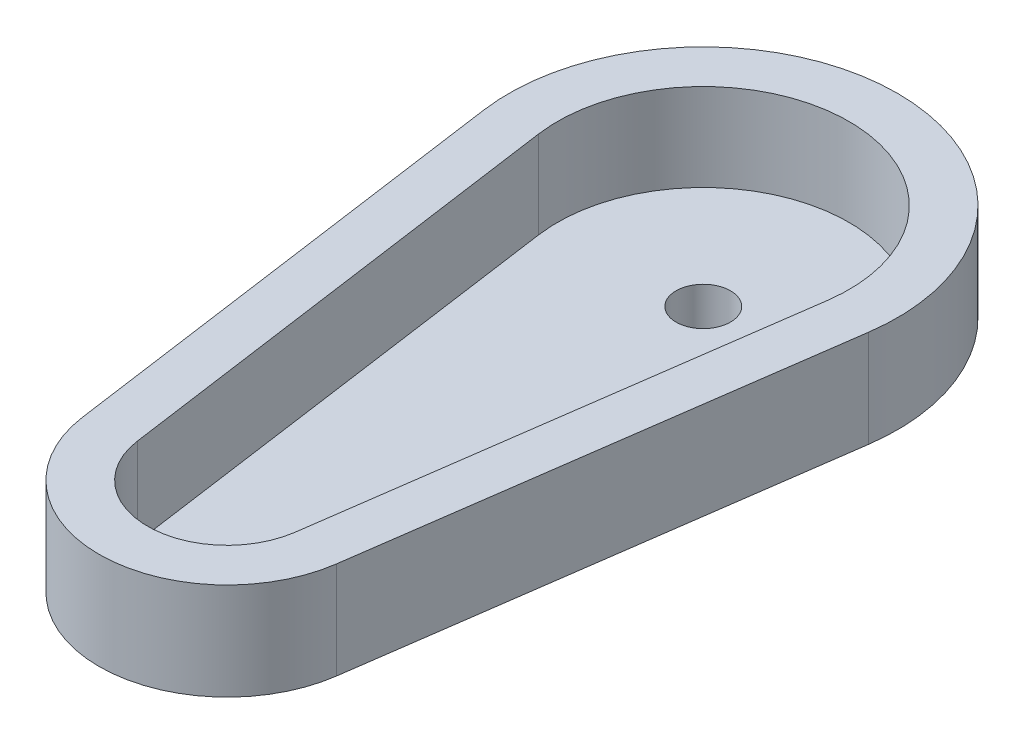
from build123d import *
from OCP.BRepFilletAPI import BRepFilletAPI_MakeChamfer

# Parameters (mm, degrees)
BOSS_EXTRUDE1_DEPTH = 2.5
BOSS_EXTRUDE2_DEPTH = 7
SKETCH3_R           = 1.4
CUT_EXTRUDE1_DEPTH  = 2.5
CHAMFER1_SIZE       = 2
CHAMFER1_SIZE2      = 3.464101615


with BuildPart() as part:
    # Sketch1 → Boss-Extrude1 (new body)
    with BuildSketch(Plane(origin=(0, 0, 0), x_dir=(1, 0, 0), z_dir=(0, 1, 0))):
        with BuildLine():
            Line((-7.427428988, -1.040816327), (-4.060327847, -25.068979592))
            ThreePointArc((-4.060327847, -25.068979592), (0, -28.6), (4.060327847, -25.068979592))
            Line((4.060327847, -25.068979592), (7.427428988, -1.040816327))
            ThreePointArc((7.427428988, -1.040816327), (0, 7.5), (-7.427428988, -1.040816327))
        make_face()
    extrude(amount=BOSS_EXTRUDE1_DEPTH)

    # Sketch2 → Boss-Extrude2 (add)
    with BuildSketch(Plane.XZ):
        with BuildLine():
            Line((9.903238651, 1.387755102), (6.53613751, 25.415918367))
            ThreePointArc((6.53613751, 25.415918367), (0, 31.1), (-6.53613751, 25.415918367))
            Line((-6.53613751, 25.415918367), (-9.903238651, 1.387755102))
            ThreePointArc((-9.903238651, 1.387755102), (0, -10), (9.903238651, 1.387755102))
        make_face()
        with BuildLine():
            Line((-7.427428988, 1.040816327), (-4.060327847, 25.068979592))
            ThreePointArc((-4.060327847, 25.068979592), (0, 28.6), (4.060327847, 25.068979592))
            Line((4.060327847, 25.068979592), (7.427428988, 1.040816327))
            ThreePointArc((7.427428988, 1.040816327), (0, -7.5), (-7.427428988, 1.040816327))
        make_face(mode=Mode.SUBTRACT)
    extrude(amount=-BOSS_EXTRUDE2_DEPTH)

    # Sketch3 → Cut-Extrude1 (cut)
    with BuildSketch(Plane(origin=(0, 2.5, 0), x_dir=(1, 0, 0), z_dir=(0, 1, 0))):
        with Locations(Location((0, 0, 0), (0, 0, 270))):
            Circle(SKETCH3_R)
        with Locations(Location((0, -24.5, 0), (0, 0, 270))):
            Circle(SKETCH3_R)
    extrude(amount=-CUT_EXTRUDE1_DEPTH, mode=Mode.SUBTRACT)

    # Chamfer1: one chamfer whose edges measure the first distance from different faces: ONE call of the kernel's chamfer builder (chamfer() names one face for all edges)
    chamfer1_edges_1 = [part.edges().sort_by_distance(p)[0] for p in [
        (0, 0, -10),
    ]]
    chamfer1_side_1 = [part.faces().sort_by_distance(p)[0] for p in [
        (0, 3.5, -10),
    ]]
    chamfer1_edges_2 = [part.edges().sort_by_distance(p)[0] for p in [
        (8.21968808, 0, 13.401836735),
    ]]
    chamfer1_side_2 = [part.faces().sort_by_distance(p)[0] for p in [
        (8.21968808, 3.5, 13.401836735),
    ]]
    chamfer1_edges_3 = [part.edges().sort_by_distance(p)[0] for p in [
        (0, 0, 31.1),
    ]]
    chamfer1_side_3 = [part.faces().sort_by_distance(p)[0] for p in [
        (0, 3.5, 31.1),
    ]]
    chamfer1_edges_4 = [part.edges().sort_by_distance(p)[0] for p in [
        (-8.21968808, 0, 13.401836735),
    ]]
    chamfer1_side_4 = [part.faces().sort_by_distance(p)[0] for p in [
        (-8.21968808, 3.5, 13.401836735),
    ]]
    chamfer1 = BRepFilletAPI_MakeChamfer(part.part.solid().wrapped)
    for e in chamfer1_edges_1:
        chamfer1.Add(CHAMFER1_SIZE, CHAMFER1_SIZE2, e.wrapped, chamfer1_side_1[0].wrapped)  # the first distance lies on this face
    for e in chamfer1_edges_2:
        chamfer1.Add(CHAMFER1_SIZE, CHAMFER1_SIZE2, e.wrapped, chamfer1_side_2[0].wrapped)  # the first distance lies on this face
    for e in chamfer1_edges_3:
        chamfer1.Add(CHAMFER1_SIZE, CHAMFER1_SIZE2, e.wrapped, chamfer1_side_3[0].wrapped)  # the first distance lies on this face
    for e in chamfer1_edges_4:
        chamfer1.Add(CHAMFER1_SIZE, CHAMFER1_SIZE2, e.wrapped, chamfer1_side_4[0].wrapped)  # the first distance lies on this face
    add(Compound.cast(chamfer1.Shape()), mode=Mode.REPLACE)


solid = part.part
